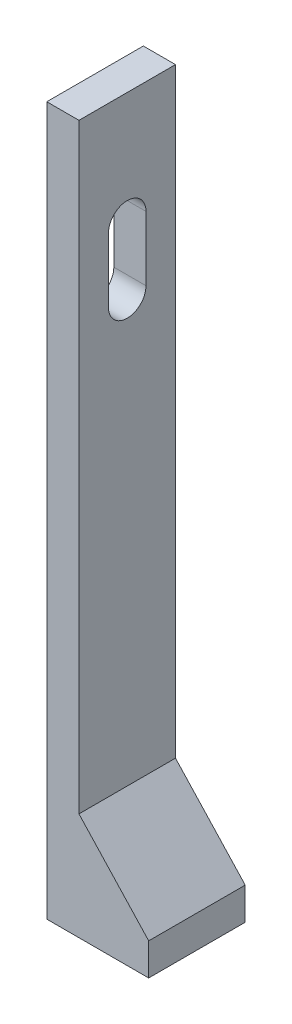
from build123d import *

# Parameters (mm, degrees)
EXTRUDE_1_DEPTH     = 9
CUT_EXTRUDE_2_DEPTH = 68.284842275
EXTRUDE_2_DEPTH     = 9


with BuildPart() as part:
    # Эскиз1 → Бобышка-Вытянуть1 (new body)
    with BuildSketch(Plane.XY):
        Polygon((0, 0), (9.5, 0), (9.5, 3), (3, 3), (3, 66), (0, 66), align=None)
    extrude(amount=EXTRUDE_1_DEPTH)

    # Эскиз4 → Вырез-Вытянуть2 (cut, through all)
    with BuildSketch(Plane.ZY):
        with BuildLine():
            Line((6.25, 55.52), (6.25, 49.52))
            ThreePointArc((6.25, 49.52), (4.5, 47.77), (2.75, 49.52))
            Line((2.75, 49.52), (2.75, 55.52))
            ThreePointArc((2.75, 55.52), (4.5, 57.27), (6.25, 55.52))
        make_face()
    extrude(amount=-CUT_EXTRUDE_2_DEPTH, mode=Mode.SUBTRACT)

    # Эскиз5 → Бобышка-Вытянуть2 (add, through all)
    with BuildSketch(Plane.XY.offset(9)):
        Polygon((3, 3), (3, 10), (9.5, 3), align=None)
    extrude(amount=-EXTRUDE_2_DEPTH)


solid = part.part
